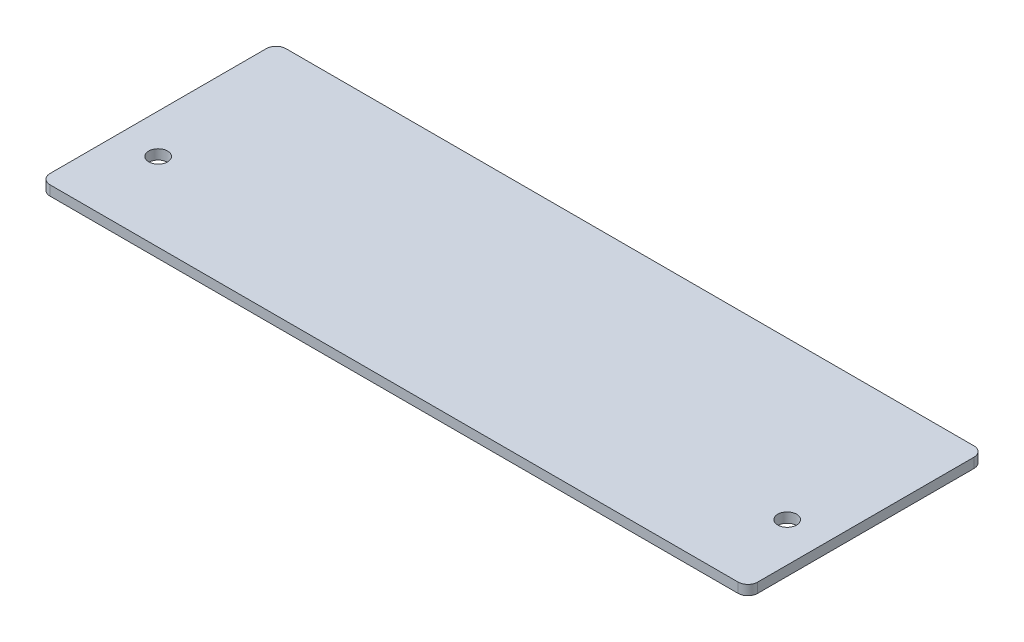
from build123d import *

# Parameters (mm, degrees)
SKETCH1_W           = 228.6
SKETCH1_H           = 76.2
BOSS_EXTRUDE1_DEPTH = 3.175
SKETCH2_R           = 3.048
CUT_EXTRUDE1_DEPTH  = 10
FILLET1_R           = 3.175


with BuildPart() as part:
    # Sketch1 → Boss-Extrude1 (new body)
    with BuildSketch(Plane(origin=(0, 0, 0), x_dir=(1, 0, 0), z_dir=(0, 1, 0))):
        Rectangle(SKETCH1_W, SKETCH1_H)
    extrude(amount=BOSS_EXTRUDE1_DEPTH)

    # Sketch2 → Cut-Extrude1 (cut)
    with BuildSketch(Plane(origin=(0, 3.175, 0), x_dir=(1, 0, 0), z_dir=(0, 1, 0))):
        with Locations(Location((-101.6, -12.7, 0), (0, 0, 270))):
            Circle(SKETCH2_R)
        with Locations(Location((101.6, -12.7, 0), (0, 0, 270))):
            Circle(SKETCH2_R)
    extrude(amount=-CUT_EXTRUDE1_DEPTH, mode=Mode.SUBTRACT)

    # Fillet1
    fillet1_edges = [part.edges().sort_by_distance(p)[0] for p in [
        (-114.3, 1.5875, -38.1),
        (114.3, 1.5875, -38.1),
        (114.3, 1.5875, 38.1),
        (-114.3, 1.5875, 38.1),
    ]]
    fillet(fillet1_edges, radius=FILLET1_R)


solid = part.part
